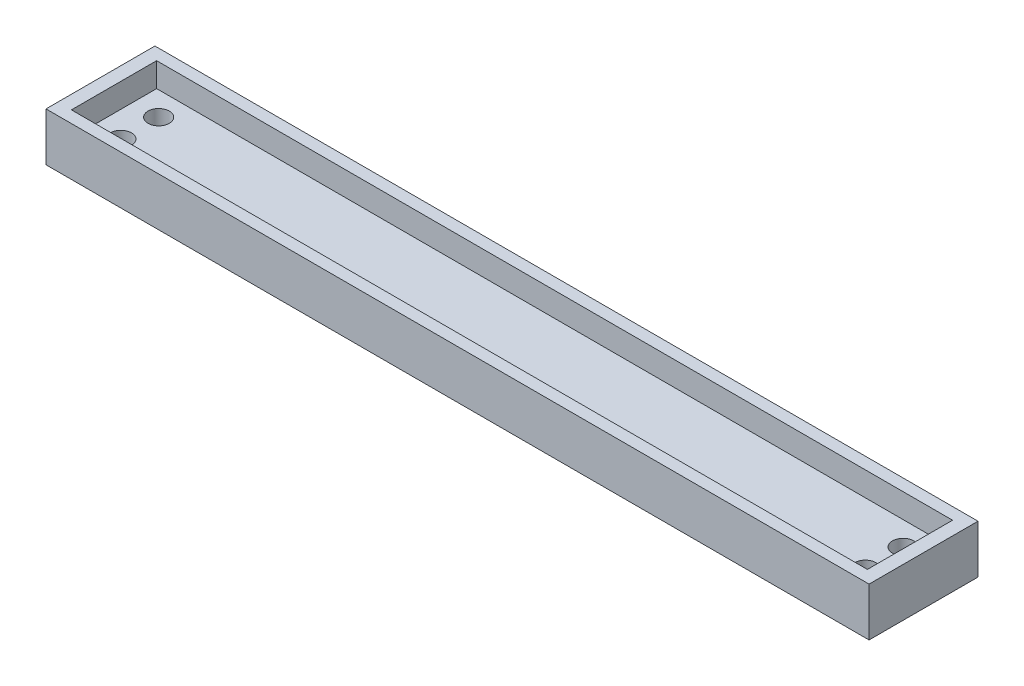
from build123d import *

# Parameters (mm, degrees)
SKETCH1_W           = 215.9
SKETCH1_H           = 28.575
BOSS_EXTRUDE1_DEPTH = 12.7
SKETCH2_W           = 208.788
SKETCH2_H           = 22.352
CUT_EXTRUDE1_DEPTH  = 6.35
SKETCH4_R           = 2.794
CUT_EXTRUDE2_DEPTH  = 218.875338497


with BuildPart() as part:
    # Sketch1 → Boss-Extrude1 (new body)
    with BuildSketch(Plane(origin=(0, 0, 0), x_dir=(1, 0, 0), z_dir=(0, 1, 0))):
        with Locations((107.95, 14.2875)):
            Rectangle(SKETCH1_W, SKETCH1_H)
    extrude(amount=BOSS_EXTRUDE1_DEPTH)

    # Sketch2 → Cut-Extrude1 (cut)
    with BuildSketch(Plane(origin=(0, 12.7, 0), x_dir=(1, 0, 0), z_dir=(0, 1, 0))):
        with Locations((107.95, 14.2875)):
            Rectangle(SKETCH2_W, SKETCH2_H)
    extrude(amount=-CUT_EXTRUDE1_DEPTH, mode=Mode.SUBTRACT)

    # Sketch4 → Cut-Extrude2 (cut, through all)
    with BuildSketch(Plane(origin=(0, 6.35, 0), x_dir=(1, 0, 0), z_dir=(0, 1, 0))):
        with Locations(Location((10.3124, 19.2405, 0), (0, 0, 270))):
            Circle(SKETCH4_R)
        with Locations(Location((10.3124, 9.3345, 0), (0, 0, 90))):
            Circle(SKETCH4_R)
        with Locations(Location((205.5876, 9.3345, 0), (0, 0, 270))):
            Circle(SKETCH4_R)
        with Locations(Location((205.5876, 19.2405, 0), (0, 0, 90))):
            Circle(SKETCH4_R)
    extrude(amount=-CUT_EXTRUDE2_DEPTH, mode=Mode.SUBTRACT)


solid = part.part
